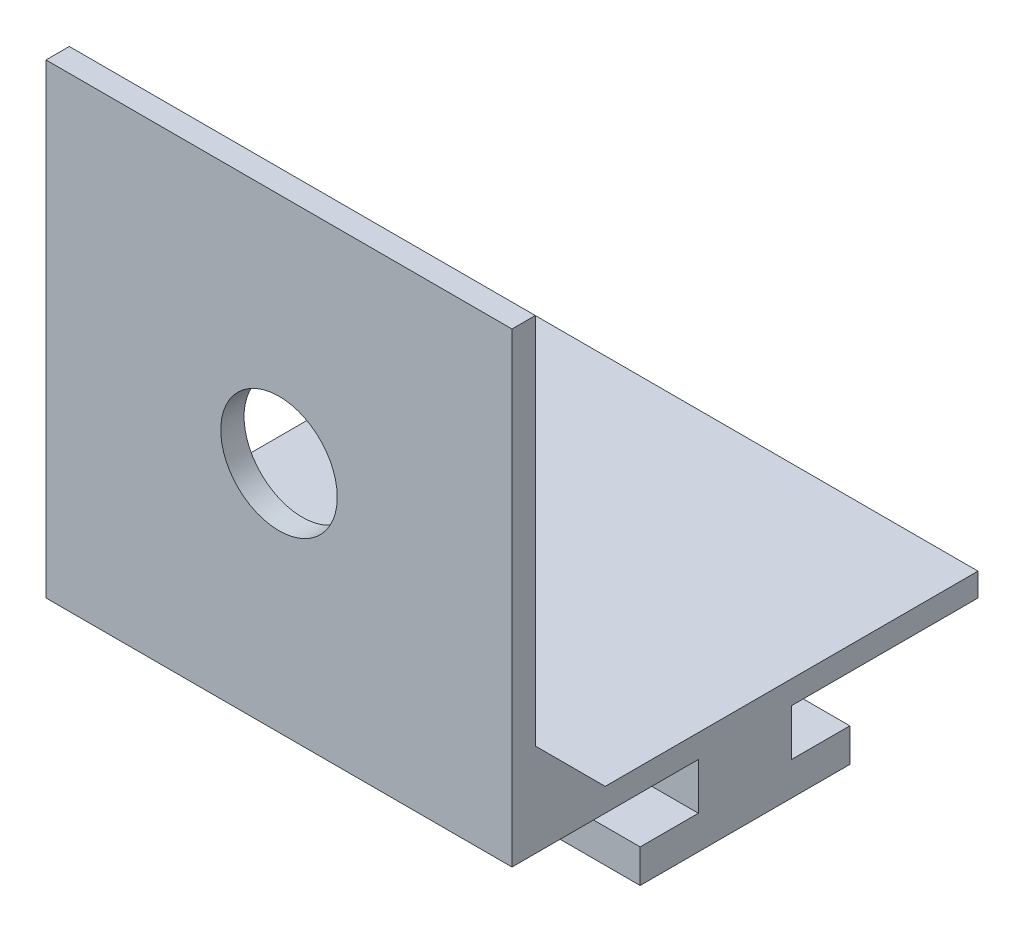
from build123d import *

# Parameters (mm, degrees)
SKETCH1_W           = 20
SKETCH1_H           = 20
BOSS_EXTRUDE1_DEPTH = 1
SKETCH2_W           = 20
SKETCH2_H           = 20
SKETCH2_R           = 2.5
BOSS_EXTRUDE2_DEPTH = 1
BOSS_EXTRUDE3_DEPTH = 20
BOSS_EXTRUDE4_START = -19
BOSS_EXTRUDE4_DEPTH = 1
BOSS_EXTRUDE5_DEPTH = 20


with BuildPart() as part:
    # Sketch1 → Boss-Extrude1 (new body)
    with BuildSketch(Plane(origin=(0, 0, 0), x_dir=(1, 0, 0), z_dir=(0, 1, 0))):
        Rectangle(SKETCH1_W, SKETCH1_H)
    extrude(amount=BOSS_EXTRUDE1_DEPTH)

    # Sketch2 → Boss-Extrude2 (add)
    with BuildSketch(Plane.XY.offset(10)):
        with Locations((0, 10)):
            Rectangle(SKETCH2_W, SKETCH2_H)
        with Locations((0, 10)):
            Circle(SKETCH2_R, mode=Mode.SUBTRACT)
    extrude(amount=-BOSS_EXTRUDE2_DEPTH)

    # Sketch3 → Boss-Extrude3 (add)
    with BuildSketch(Plane(origin=(10, 0, 0), x_dir=(0, 0, -1), z_dir=(1, 0, 0))):
        Polygon((-9, 4), (-6, 1), (-9, 1), align=None)
    extrude(amount=-BOSS_EXTRUDE3_DEPTH)

    # Sketch3<2> → Boss-Extrude4 (add)
    with BuildSketch(Plane(origin=(10, 0, 0), x_dir=(0, 0, -1), z_dir=(1, 0, 0)).offset(BOSS_EXTRUDE4_START)):
        Polygon((-9, 4), (-6, 1), (-9, 1), align=None)
    extrude(amount=-BOSS_EXTRUDE4_DEPTH)

    # Sketch4 → Boss-Extrude5 (add)
    with BuildSketch(Plane(origin=(10, 0, 0), x_dir=(0, 0, -1), z_dir=(1, 0, 0))):
        Polygon((-2, 0), (-2, -2), (-4.5, -2), (-4.5, -3.436102186), (4.5, -3.436102186), (4.5, -2), (2, -2), (2, 0), align=None)
    extrude(amount=-BOSS_EXTRUDE5_DEPTH)


solid = part.part
